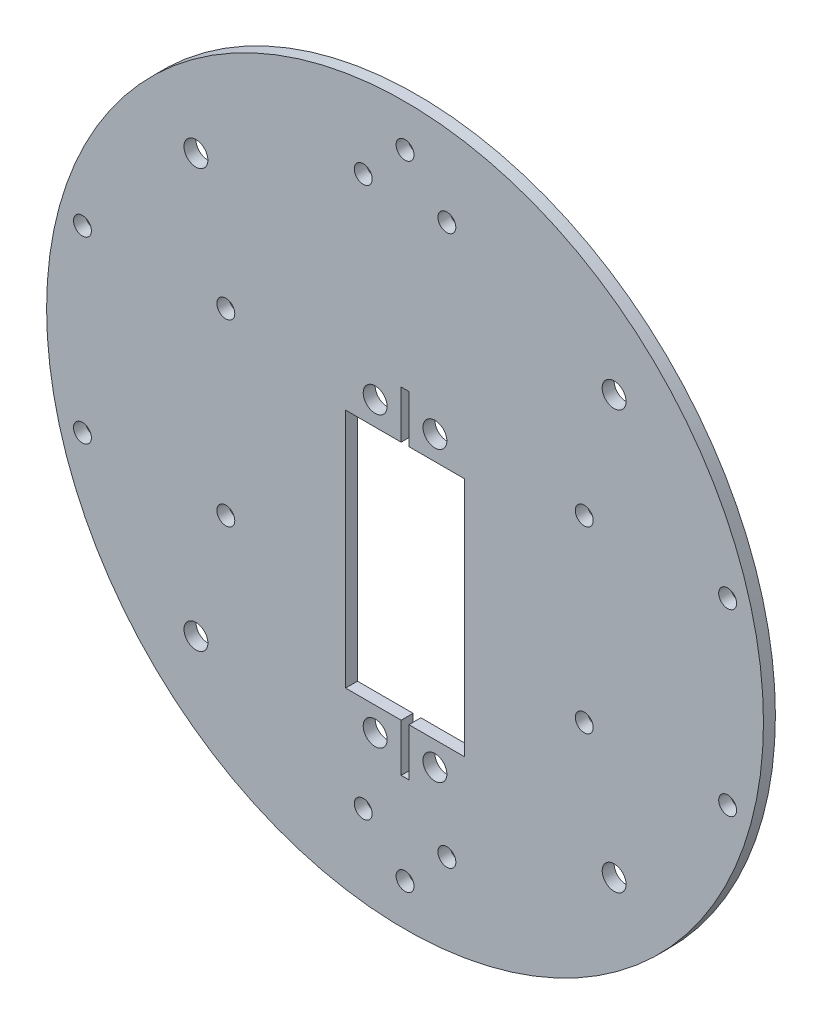
from build123d import *

# Parameters (mm, degrees)
SKETCH_2_R          = 60
SKETCH_2_R_2        = 2
SKETCH_2_R_3        = 1.5
SKETCH_2_R_4        = 3
EXTRUDE_1_DEPTH     = 2
SKETCH_3_W          = 8.162362301
SKETCH_3_H          = 40.485317015
SKETCH_3_W_2        = 27.139793893
SKETCH_3_H_2        = 21.022636522
SKETCH_3_W_3        = 14.584458286
SKETCH_3_H_3        = 6.050391253
SKETCH_3_W_4        = 48.855816311
SKETCH_3_H_4        = 12.892308022
SKETCH_3_W_5        = 12.892308022
SKETCH_3_H_5        = 4.570909208
SKETCH_3_W_6        = 8.878366521
SKETCH_3_H_6        = 39.087895811
SKETCH_3_W_7        = 19.7981782
SKETCH_3_H_7        = 10.309650399
SKETCH_3_W_8        = 26.666087392
SKETCH_3_H_8        = 19.852345115
SKETCH_3_W_9        = 13.786410289
SKETCH_3_H_9        = 7.740059667
SKETCH_3_H_10       = 6.89183395
SKETCH_3_W_10       = 7.924486085
EXTRUDE_2_DEPTH     = 2
CUT_EXTRUDE_START   = -2
SKETCH_4_R          = 1.5
CUT_EXTRUDE_1_DEPTH = 2


with BuildPart() as part:
    # 草图2 → 凸台-拉伸1 (new body)
    with BuildSketch(Plane.XY):
        with Locations((1.685455035, 17.759933031)):
            Circle(SKETCH_2_R)
        with Locations((-3.312759296, 32.050802338)):
            Circle(SKETCH_2_R_2, mode=Mode.SUBTRACT)
        with Locations((6.687240704, -16.249197662)):
            Circle(SKETCH_2_R_2, mode=Mode.SUBTRACT)
        with Locations((-3.312759296, -16.249197662)):
            Circle(SKETCH_2_R_2, mode=Mode.SUBTRACT)
        with Locations((-28.312759296, 32.758147453)):
            Circle(SKETCH_2_R_3, mode=Mode.SUBTRACT)
        with Locations((-52.312759296, 32.758147453)):
            Circle(SKETCH_2_R_3, mode=Mode.SUBTRACT)
        with Locations((-28.312759296, 2.758147453)):
            Circle(SKETCH_2_R_3, mode=Mode.SUBTRACT)
        with Locations((-52.312759296, 2.758147453)):
            Circle(SKETCH_2_R_3, mode=Mode.SUBTRACT)
        with Locations((31.687240704, 32.758147453)):
            Circle(SKETCH_2_R_3, mode=Mode.SUBTRACT)
        with Locations((55.687240704, 32.758147453)):
            Circle(SKETCH_2_R_3, mode=Mode.SUBTRACT)
        with Locations((31.687240704, 2.758147453)):
            Circle(SKETCH_2_R_3, mode=Mode.SUBTRACT)
        with Locations((55.687240704, 2.758147453)):
            Circle(SKETCH_2_R_3, mode=Mode.SUBTRACT)
        with Locations((36.689025917, -17.236495723)):
            Circle(SKETCH_2_R_2, mode=Mode.SUBTRACT)
        with Locations((-33.310973719, -17.243637851)):
            Circle(SKETCH_2_R_2, mode=Mode.SUBTRACT)
        with Locations((-33.318115847, 52.756361784)):
            Circle(SKETCH_2_R_2, mode=Mode.SUBTRACT)
        with Locations((36.681883788, 52.763503913)):
            Circle(SKETCH_2_R_2, mode=Mode.SUBTRACT)
        with Locations((-12.312759296, -3.241852547)):
            Circle(SKETCH_2_R_3, mode=Mode.SUBTRACT)
        with Locations((15.687240704, -3.241852547)):
            Circle(SKETCH_2_R_3, mode=Mode.SUBTRACT)
        with Locations((42.687240704, 24.758147453)):
            Circle(SKETCH_2_R_3, mode=Mode.SUBTRACT)
        with Locations((42.687240704, 10.758147453)):
            Circle(SKETCH_2_R_3, mode=Mode.SUBTRACT)
        with Locations((35.687240704, 17.758147453)):
            Circle(SKETCH_2_R_3, mode=Mode.SUBTRACT)
        with Locations((-39.312759296, 24.758147453)):
            Circle(SKETCH_2_R_3, mode=Mode.SUBTRACT)
        with Locations((-39.312759296, 10.758147453)):
            Circle(SKETCH_2_R_3, mode=Mode.SUBTRACT)
        with Locations((-32.312759296, 17.758147453)):
            Circle(SKETCH_2_R_3, mode=Mode.SUBTRACT)
        with Locations((1.687240704, -35.241852547)):
            Circle(SKETCH_2_R_3, mode=Mode.SUBTRACT)
        with Locations((6.687240704, 32.050802338)):
            Circle(SKETCH_2_R_2, mode=Mode.SUBTRACT)
        with Locations((1.687240704, -28.241852547)):
            Circle(SKETCH_2_R_4, mode=Mode.SUBTRACT)
        with Locations((8.687240704, -28.241852547)):
            Circle(SKETCH_2_R_3, mode=Mode.SUBTRACT)
        with Locations((-5.312759296, -28.241852547)):
            Circle(SKETCH_2_R_3, mode=Mode.SUBTRACT)
        with Locations((49.687240704, 10.758147453)):
            Circle(SKETCH_2_R_3, mode=Mode.SUBTRACT)
        with Locations((42.687240704, 17.758147453)):
            Circle(SKETCH_2_R_3, mode=Mode.SUBTRACT)
        with Locations((49.687240704, 24.758147453)):
            Circle(SKETCH_2_R_3, mode=Mode.SUBTRACT)
        with Locations((-39.312759296, 17.758147453)):
            Circle(SKETCH_2_R_3, mode=Mode.SUBTRACT)
        with Locations((-46.312759296, 10.758147453)):
            Circle(SKETCH_2_R_3, mode=Mode.SUBTRACT)
        with Locations((-46.312759296, 24.758147453)):
            Circle(SKETCH_2_R_3, mode=Mode.SUBTRACT)
        with Locations((1.687240704, 70.758147453)):
            Circle(SKETCH_2_R_3, mode=Mode.SUBTRACT)
        with Locations((1.687240704, 56.758147453)):
            Circle(SKETCH_2_R_3, mode=Mode.SUBTRACT)
        Polygon((1.037240704, -12.244197662), (1.037240704, -20.244197662), (2.337240704, -20.244197662), (2.337240704, -12.244197662), (11.646691261, -12.244197662), (11.646691261, 28.055802338), (2.337240704, 28.055802338), (2.337240704, 36.055802338), (1.037240704, 36.055802338), (1.037240704, 28.055802338), (-8.272209854, 28.055802338), (-8.272209854, -12.244197662), align=None, mode=Mode.SUBTRACT)
        with BuildLine():
            Line((14.187240704, 13.758147453), (14.187240704, 7.758147453))
            ThreePointArc((14.187240704, 7.758147453), (15.687240704, 6.258147453), (17.187240704, 7.758147453))
            Line((17.187240704, 7.758147453), (17.187240704, 13.758147453))
            ThreePointArc((17.187240704, 13.758147453), (15.687240704, 15.258147453), (14.187240704, 13.758147453))
        make_face(mode=Mode.SUBTRACT)
        with BuildLine():
            Line((-10.812759296, 7.758147453), (-10.812759296, 13.758147453))
            ThreePointArc((-10.812759296, 13.758147453), (-12.312759296, 15.258147453), (-13.812759296, 13.758147453))
            Line((-13.812759296, 13.758147453), (-13.812759296, 7.758147453))
            ThreePointArc((-13.812759296, 7.758147453), (-12.312759296, 6.258147453), (-10.812759296, 7.758147453))
        make_face(mode=Mode.SUBTRACT)
        with BuildLine():
            Line((-10.812759296, 21.758147453), (-10.812759296, 27.758147453))
            ThreePointArc((-10.812759296, 27.758147453), (-12.312759296, 29.258147453), (-13.812759296, 27.758147453))
            Line((-13.812759296, 27.758147453), (-13.812759296, 21.758147453))
            ThreePointArc((-13.812759296, 21.758147453), (-12.312759296, 20.258147453), (-10.812759296, 21.758147453))
        make_face(mode=Mode.SUBTRACT)
        with BuildLine():
            Line((17.187240704, 21.758147453), (17.187240704, 27.758147453))
            ThreePointArc((17.187240704, 27.758147453), (15.687240704, 29.258147453), (14.187240704, 27.758147453))
            Line((14.187240704, 27.758147453), (14.187240704, 21.758147453))
            ThreePointArc((14.187240704, 21.758147453), (15.687240704, 20.258147453), (17.187240704, 21.758147453))
        make_face(mode=Mode.SUBTRACT)
        with BuildLine():
            Line((15.687240704, -29.741852547), (22.687240704, -29.741852547))
            ThreePointArc((22.687240704, -29.741852547), (24.187240704, -28.241852547), (22.687240704, -26.741852547))
            Line((22.687240704, -26.741852547), (15.687240704, -26.741852547))
            ThreePointArc((15.687240704, -26.741852547), (14.187240704, -28.241852547), (15.687240704, -29.741852547))
        make_face(mode=Mode.SUBTRACT)
        with BuildLine():
            Line((-19.312759296, -29.741852547), (-12.312759296, -29.741852547))
            ThreePointArc((-12.312759296, -29.741852547), (-10.812759296, -28.241852547), (-12.312759296, -26.741852547))
            Line((-12.312759296, -26.741852547), (-19.312759296, -26.741852547))
            ThreePointArc((-19.312759296, -26.741852547), (-20.812759296, -28.241852547), (-19.312759296, -29.741852547))
        make_face(mode=Mode.SUBTRACT)
        with BuildLine():
            Line((-19.312759296, 62.258147453), (-12.312759296, 62.258147453))
            ThreePointArc((-12.312759296, 62.258147453), (-10.812759296, 63.758147453), (-12.312759296, 65.258147453))
            Line((-12.312759296, 65.258147453), (-19.312759296, 65.258147453))
            ThreePointArc((-19.312759296, 65.258147453), (-20.812759296, 63.758147453), (-19.312759296, 62.258147453))
        make_face(mode=Mode.SUBTRACT)
        with BuildLine():
            Line((15.687240704, 62.258147453), (22.687240704, 62.258147453))
            ThreePointArc((22.687240704, 62.258147453), (24.187240704, 63.758147453), (22.687240704, 65.258147453))
            Line((22.687240704, 65.258147453), (15.687240704, 65.258147453))
            ThreePointArc((15.687240704, 65.258147453), (14.187240704, 63.758147453), (15.687240704, 62.258147453))
        make_face(mode=Mode.SUBTRACT)
        with BuildLine():
            Line((-19.312759296, 37.258147453), (-12.312759296, 37.258147453))
            ThreePointArc((-12.312759296, 37.258147453), (-10.812759296, 38.758147453), (-12.312759296, 40.258147453))
            Line((-12.312759296, 40.258147453), (-19.312759296, 40.258147453))
            ThreePointArc((-19.312759296, 40.258147453), (-20.812759296, 38.758147453), (-19.312759296, 37.258147453))
        make_face(mode=Mode.SUBTRACT)
        with BuildLine():
            Line((15.687240704, 37.258147453), (22.687240704, 37.258147453))
            ThreePointArc((22.687240704, 37.258147453), (24.187240704, 38.758147453), (22.687240704, 40.258147453))
            Line((22.687240704, 40.258147453), (15.687240704, 40.258147453))
            ThreePointArc((15.687240704, 40.258147453), (14.187240704, 38.758147453), (15.687240704, 37.258147453))
        make_face(mode=Mode.SUBTRACT)
        with BuildLine():
            Line((49.687240704, 16.258147453), (55.687240704, 16.258147453))
            ThreePointArc((55.687240704, 16.258147453), (57.187240704, 17.758147453), (55.687240704, 19.258147453))
            Line((55.687240704, 19.258147453), (49.687240704, 19.258147453))
            ThreePointArc((49.687240704, 19.258147453), (48.187240704, 17.758147453), (49.687240704, 16.258147453))
        make_face(mode=Mode.SUBTRACT)
        with BuildLine():
            Line((-52.312759296, 16.258147453), (-46.312759296, 16.258147453))
            ThreePointArc((-46.312759296, 16.258147453), (-44.812759296, 17.758147453), (-46.312759296, 19.258147453))
            Line((-46.312759296, 19.258147453), (-52.312759296, 19.258147453))
            ThreePointArc((-52.312759296, 19.258147453), (-53.812759296, 17.758147453), (-52.312759296, 16.258147453))
        make_face(mode=Mode.SUBTRACT)
        with BuildLine():
            Line((-5.312759296, 62.258147453), (8.687240704, 62.258147453))
            ThreePointArc((8.687240704, 62.258147453), (10.187240704, 63.758147453), (8.687240704, 65.258147453))
            Line((8.687240704, 65.258147453), (-5.312759296, 65.258147453))
            ThreePointArc((-5.312759296, 65.258147453), (-6.812759296, 63.758147453), (-5.312759296, 62.258147453))
        make_face(mode=Mode.SUBTRACT)
    extrude(amount=EXTRUDE_1_DEPTH)

    # 草图3 → 凸台-拉伸2 (add)
    with BuildSketch(Plane.XY.offset(2)):
        with Locations((17.217326503, 12.100585091)):
            Rectangle(SKETCH_3_W, SKETCH_3_H)
        with Locations((44.335143259, 17.544484077)):
            Rectangle(SKETCH_3_W_2, SKETCH_3_H_2)
        with Locations((18.938920404, 39.55084589)):
            Rectangle(SKETCH_3_W_3, SKETCH_3_H_3)
        with Locations((1.803241392, 60.205478663)):
            Rectangle(SKETCH_3_W_4, SKETCH_3_H_4)
        with Locations((1.519110076, 70.929534881)):
            Rectangle(SKETCH_3_W_5, SKETCH_3_H_5)
        with Locations((-14.004777279, 12.799295692)):
            Rectangle(SKETCH_3_W_6, SKETCH_3_H_6)
        with Locations((-16.949963373, 40.447632517)):
            Rectangle(SKETCH_3_W_7, SKETCH_3_H_7)
        with Locations((-42.027713724, 17.831974896)):
            Rectangle(SKETCH_3_W_8, SKETCH_3_H_8)
        with Locations((-16.458799163, -28.067961655)):
            Rectangle(SKETCH_3_W_9, SKETCH_3_H_9)
        with Locations((18.938920404, -27.643848796)):
            Rectangle(SKETCH_3_W_3, SKETCH_3_H_10)
        with Locations((1.711416609, -28.067961655)):
            Rectangle(SKETCH_3_W_10, SKETCH_3_H_9)
    extrude(amount=-EXTRUDE_2_DEPTH)

    # 草图4 → 切除-拉伸1 (cut)
    with BuildSketch(Plane.XY.offset(2).offset(CUT_EXTRUDE_START)):
        with Locations((1.687240704, -35.241852547)):
            Circle(SKETCH_4_R)
        with Locations((-5.312759296, -28.241852547)):
            Circle(SKETCH_4_R)
        with Locations((8.687240704, -28.241852547)):
            Circle(SKETCH_4_R)
        with Locations(Location((8.687240704, 63.761718608, 0), (0, 0, 180))):
            Circle(SKETCH_4_R)
        with Locations(Location((-5.312759296, 63.761718608, 0), (0, 0, 180))):
            Circle(SKETCH_4_R)
        with Locations(Location((1.687240704, 70.761718608, 0), (0, 0, 180))):
            Circle(SKETCH_4_R)
    extrude(amount=CUT_EXTRUDE_1_DEPTH, mode=Mode.SUBTRACT)


solid = part.part
